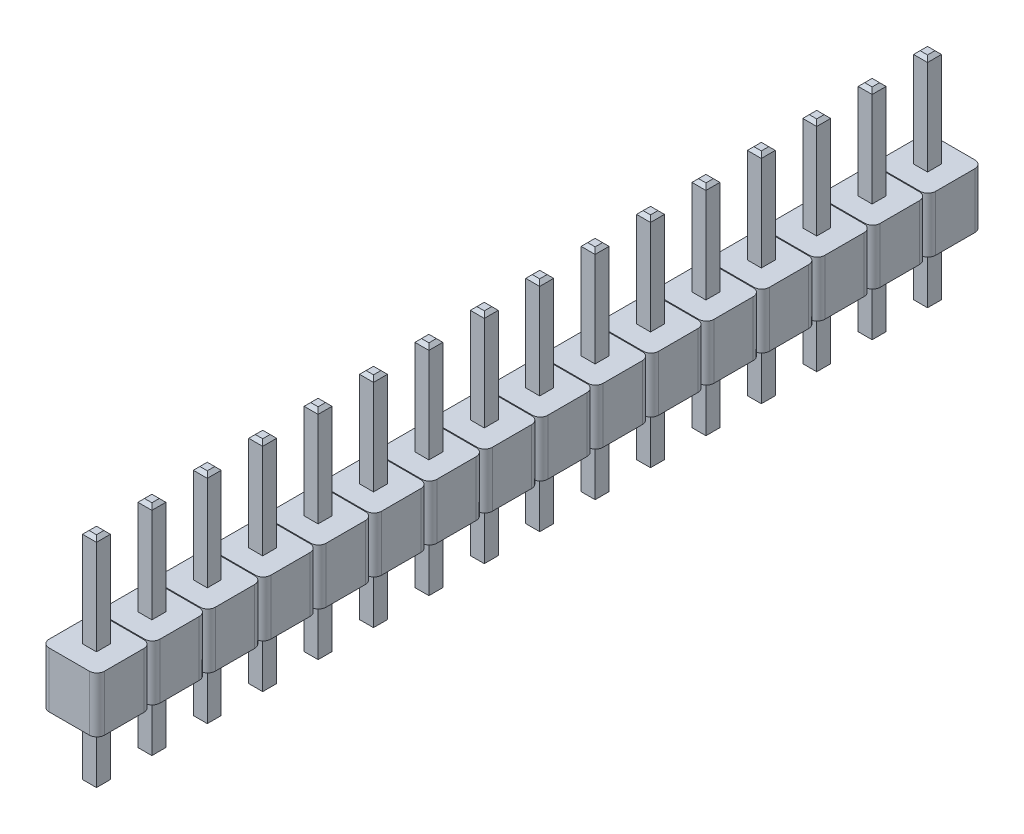
from build123d import *

# Parameters (mm, degrees)
SKETCH1_W           = 0.64
SKETCH1_H           = 0.64
BOSS_EXTRUDE1_DEPTH = 10.04
CHAMFER1_SIZE       = 0.15
BOSS_EXTRUDE2_DEPTH = 2.54
LPATTERN2_COUNT     = 16
LPATTERN2_PITCH     = 2.54


with BuildPart() as part:
    # Sketch1 → Boss-Extrude1 (new body)
    with BuildSketch(Plane(origin=(0, 0, 0), x_dir=(1, 0, 0), z_dir=(0, 1, 0))):
        with Locations((0.32, 0.32)):
            Rectangle(SKETCH1_W, SKETCH1_H)
    extrude(amount=BOSS_EXTRUDE1_DEPTH)

    # Chamfer1
    chamfer1_edges = [part.edges().sort_by_distance(p)[0] for p in [
        (0.32, 0, 0),
        (0.64, 0, -0.32),
        (0.32, 0, -0.64),
        (0, 0, -0.32),
        (0.32, 10.04, -0.64),
        (0.64, 10.04, -0.32),
        (0.32, 10.04, 0),
        (0, 10.04, -0.32),
    ]]
    chamfer(chamfer1_edges, length=CHAMFER1_SIZE)

    # Sketch3 → Boss-Extrude2 (add)
    with BuildSketch(Plane(origin=(0, 5.54, 0), x_dir=(1, 0, 0), z_dir=(0, 1, 0))):
        with BuildLine():
            Line((-0.6, -0.93), (1.24, -0.93))
            ThreePointArc((1.24, -0.93), (1.487487373, -0.827487373), (1.59, -0.58))
            Line((1.59, -0.58), (1.59, 1.22))
            ThreePointArc((1.59, 1.22), (1.487487373, 1.467487373), (1.24, 1.57))
            Line((1.24, 1.57), (-0.6, 1.57))
            ThreePointArc((-0.6, 1.57), (-0.847487373, 1.467487373), (-0.95, 1.22))
            Line((-0.95, 1.22), (-0.95, -0.58))
            ThreePointArc((-0.95, -0.58), (-0.847487373, -0.827487373), (-0.6, -0.93))
        make_face()
    extrude(amount=-BOSS_EXTRUDE2_DEPTH)


with BuildPart() as lpattern2_1:
    # LPattern2: pattern copy
    add(part.part.moved(Location(Vector(0, 0, -1) * (1 * LPATTERN2_PITCH))))


with BuildPart() as lpattern2_2:
    # LPattern2: pattern copy
    add(part.part.moved(Location(Vector(0, 0, -1) * (2 * LPATTERN2_PITCH))))


with BuildPart() as lpattern2_3:
    # LPattern2: pattern copy
    add(part.part.moved(Location(Vector(0, 0, -1) * (3 * LPATTERN2_PITCH))))


with BuildPart() as lpattern2_4:
    # LPattern2: pattern copy
    add(part.part.moved(Location(Vector(0, 0, -1) * (4 * LPATTERN2_PITCH))))


with BuildPart() as lpattern2_5:
    # LPattern2: pattern copy
    add(part.part.moved(Location(Vector(0, 0, -1) * (5 * LPATTERN2_PITCH))))


with BuildPart() as lpattern2_6:
    # LPattern2: pattern copy
    add(part.part.moved(Location(Vector(0, 0, -1) * (6 * LPATTERN2_PITCH))))


with BuildPart() as lpattern2_7:
    # LPattern2: pattern copy
    add(part.part.moved(Location(Vector(0, 0, -1) * (7 * LPATTERN2_PITCH))))


with BuildPart() as lpattern2_8:
    # LPattern2: pattern copy
    add(part.part.moved(Location(Vector(0, 0, -1) * (8 * LPATTERN2_PITCH))))


with BuildPart() as lpattern2_9:
    # LPattern2: pattern copy
    add(part.part.moved(Location(Vector(0, 0, -1) * (9 * LPATTERN2_PITCH))))


with BuildPart() as lpattern2_10:
    # LPattern2: pattern copy
    add(part.part.moved(Location(Vector(0, 0, -1) * (10 * LPATTERN2_PITCH))))


with BuildPart() as lpattern2_11:
    # LPattern2: pattern copy
    add(part.part.moved(Location(Vector(0, 0, -1) * (11 * LPATTERN2_PITCH))))


with BuildPart() as lpattern2_12:
    # LPattern2: pattern copy
    add(part.part.moved(Location(Vector(0, 0, -1) * (12 * LPATTERN2_PITCH))))


with BuildPart() as lpattern2_13:
    # LPattern2: pattern copy
    add(part.part.moved(Location(Vector(0, 0, -1) * (13 * LPATTERN2_PITCH))))


with BuildPart() as lpattern2_14:
    # LPattern2: pattern copy
    add(part.part.moved(Location(Vector(0, 0, -1) * (14 * LPATTERN2_PITCH))))


with BuildPart() as lpattern2_15:
    # LPattern2: pattern copy
    add(part.part.moved(Location(Vector(0, 0, -1) * (15 * LPATTERN2_PITCH))))


solid = Compound([part.part, lpattern2_1.part, lpattern2_2.part, lpattern2_3.part, lpattern2_4.part, lpattern2_5.part, lpattern2_6.part, lpattern2_7.part, lpattern2_8.part, lpattern2_9.part, lpattern2_10.part, lpattern2_11.part, lpattern2_12.part, lpattern2_13.part, lpattern2_14.part, lpattern2_15.part])
